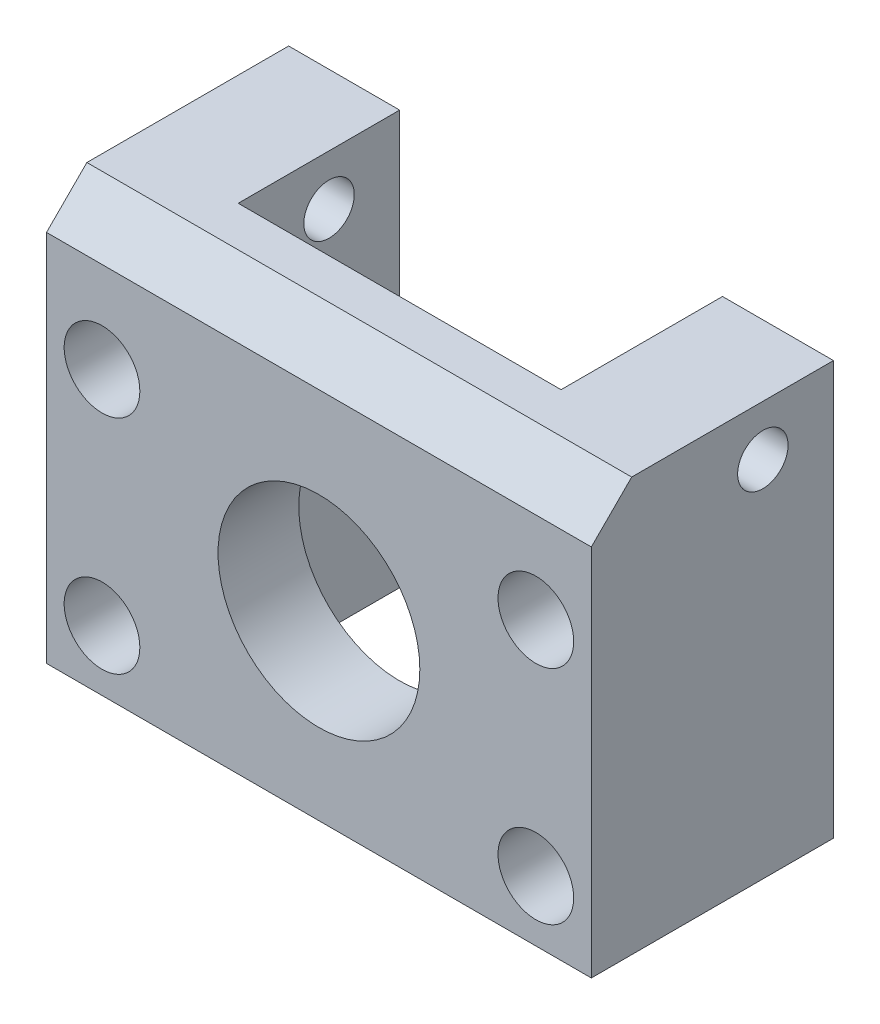
from build123d import *

# Parameters (mm, degrees)
CROQUIS1_W              = 54
CROQUIS1_H              = 41
CROQUIS1_R              = 3.75
SALIENTE_EXTRUIR1_DEPTH = 24
CROQUIS2_W              = 32
CROQUIS2_H              = 41
CORTAR_EXTRUIR1_DEPTH   = 16
CROQUIS3_R              = 2.5
CORTAR_EXTRUIR2_DEPTH   = 63.547981582
CHAFL_N1_SIZE           = 4
CORTAR_EXTRUIR3_REACH   = 43.536
CROQUIS4_R              = 10


with BuildPart() as part:
    # Croquis1 → Saliente-Extruir1 (new body)
    with BuildSketch(Plane.XY):
        Rectangle(CROQUIS1_W, CROQUIS1_H)
        with Locations((-21.5, 7.5)):
            Circle(CROQUIS1_R, mode=Mode.SUBTRACT)
        with Locations((21.5, 7.5)):
            Circle(CROQUIS1_R, mode=Mode.SUBTRACT)
        with Locations((21.5, -14.5)):
            Circle(CROQUIS1_R, mode=Mode.SUBTRACT)
        with Locations((-21.5, -14.5)):
            Circle(CROQUIS1_R, mode=Mode.SUBTRACT)
    extrude(amount=-SALIENTE_EXTRUIR1_DEPTH)

    # Croquis2 → Cortar-Extruir1 (cut)
    with BuildSketch(Plane(origin=(0, 0, -24), x_dir=(-1, 0, 0), z_dir=(0, 0, -1))):
        Rectangle(CROQUIS2_W, CROQUIS2_H)
    extrude(amount=-CORTAR_EXTRUIR1_DEPTH, mode=Mode.SUBTRACT)

    # Croquis3 → Cortar-Extruir2 (cut, through all)
    with BuildSketch(Plane(origin=(27, 0, 0), x_dir=(0, 0, -1), z_dir=(1, 0, 0))):
        with Locations(Location((17, 15.5, 0), (0, 0, 90))):
            Circle(CROQUIS3_R)
    extrude(amount=-CORTAR_EXTRUIR2_DEPTH, mode=Mode.SUBTRACT)

    # Chaflán1
    chafl_n1_edges = [part.edges().sort_by_distance(p)[0] for p in [
        (0, 20.5, 0),
    ]]
    chamfer(chafl_n1_edges, length=CHAFL_N1_SIZE)

    # Croquis4 → Cortar-Extruir3 (cut, up to next)
    with BuildSketch(Plane.XY, mode=Mode.PRIVATE) as cortar_extruir3_sk1:
        with Locations((0, -2.5)):
            Circle(CROQUIS4_R)
    cortar_extruir3_tool1 = extrude(cortar_extruir3_sk1.sketch, amount=-CORTAR_EXTRUIR3_REACH, mode=Mode.PRIVATE) & part.part
    add(cortar_extruir3_tool1.solids().sort_by_distance((0, -2.5, 0))[0], mode=Mode.SUBTRACT)


solid = part.part
